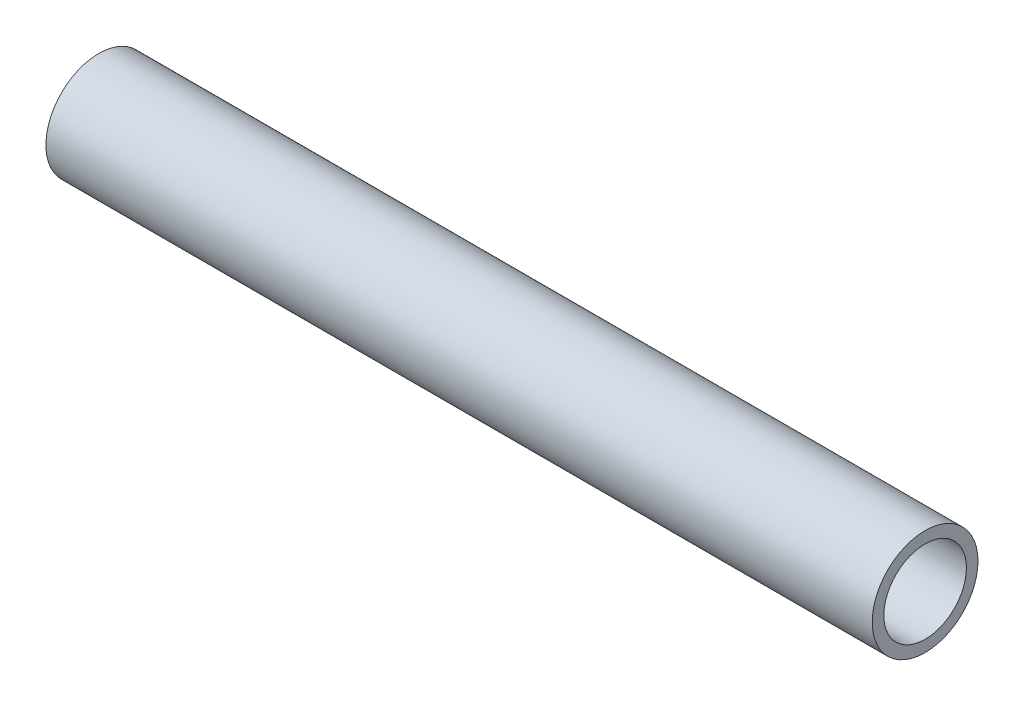
from build123d import *

# Parameters (mm, degrees)
SKETCH1_R           = 4.064
SKETCH1_R_2         = 3.175
BOSS_EXTRUDE1_DEPTH = 63.5


with BuildPart() as part:
    # Sketch1 → Boss-Extrude1 (new body)
    with BuildSketch(Plane(origin=(0, 0, 0), x_dir=(0, 0, -1), z_dir=(1, 0, 0))):
        Circle(SKETCH1_R)
        Circle(SKETCH1_R_2, mode=Mode.SUBTRACT)
    extrude(amount=BOSS_EXTRUDE1_DEPTH)


solid = part.part
